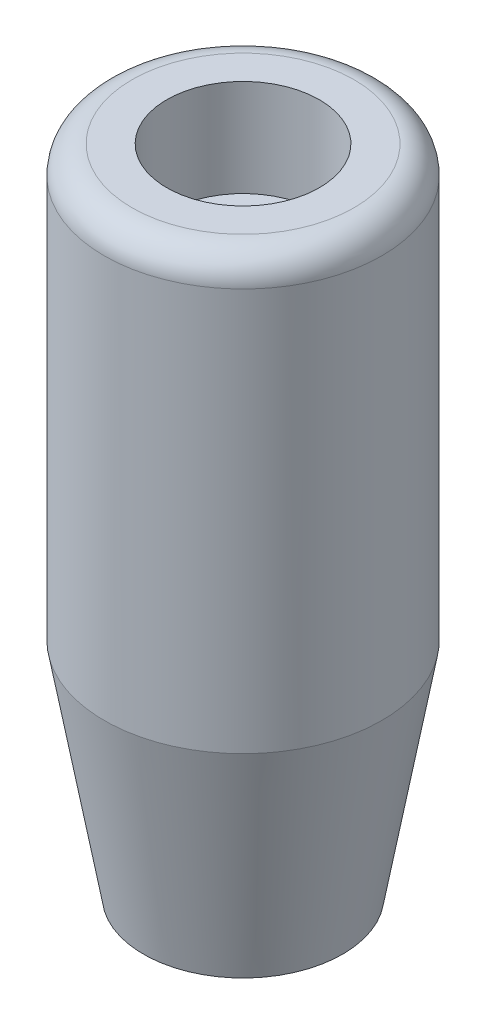
from build123d import *

# Parameters (mm, degrees)
CONG_1_R = 2


with BuildPart() as part:
    # Esquisse1 → Révolution1 (revolve)
    with BuildSketch(Plane.XY, mode=Mode.PRIVATE) as r_volution1_sk:
        Polygon((3.1, 0), (3.1, 40), (5.5, 40), (5.5, 47), (10, 47), (10, 16), (7.178768309, 0), align=None)
    revolve(r_volution1_sk.sketch.rotate(Axis((0, 0, 0), (0, 1, 0)), 90), axis=Axis((0, 0, 0), (0, 1, 0)))

    # Congé1
    cong_1_edges = [part.edges().sort_by_distance(p)[0] for p in [
        (0, 47, 10),
    ]]
    fillet(cong_1_edges, radius=CONG_1_R)


solid = part.part
